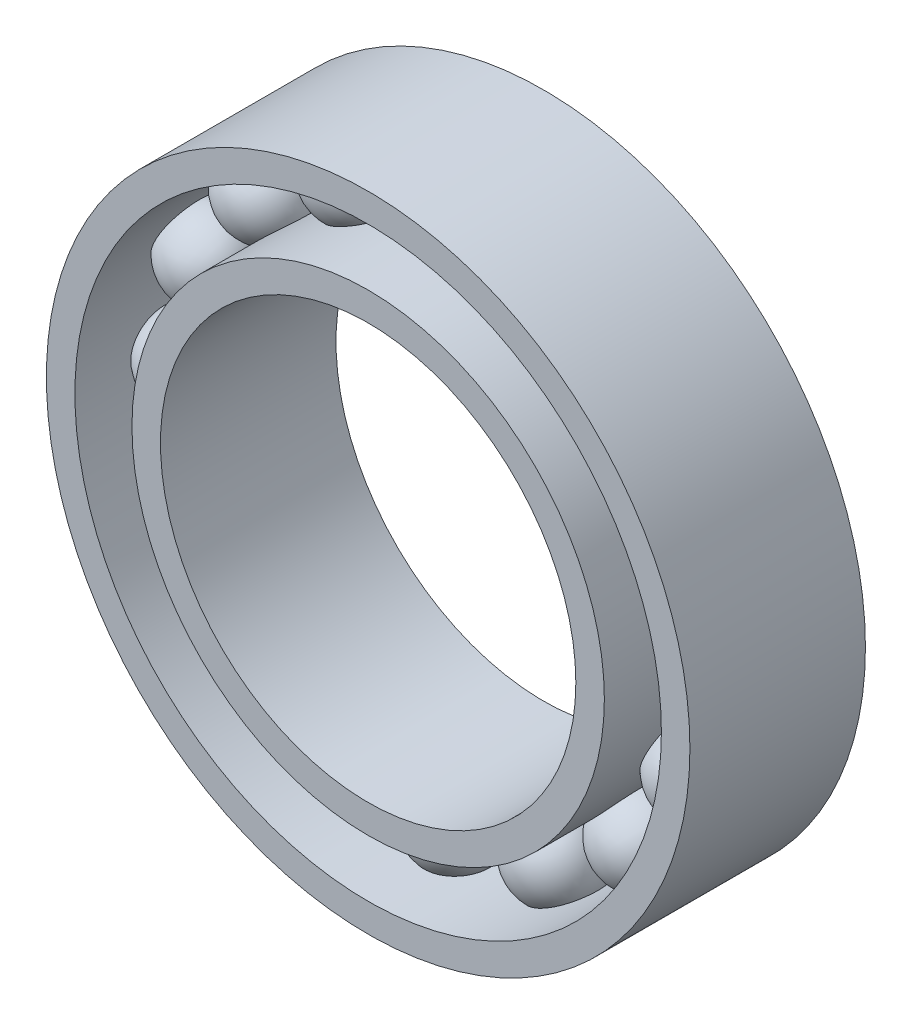
from build123d import *

# Parameters (mm, degrees)
SKETCH1_R           = 5.5
SKETCH1_R_2         = 3.55
BOSS_EXTRUDE1_DEPTH = 3
CUT_EXTRUDE1_REACH  = 10.337
SKETCH2_R           = 5.0125
SKETCH2_R_2         = 4.0375
CIRPATTERN1_COUNT   = 16


with BuildPart() as part:
    # Sketch1 → Boss-Extrude1 (new body)
    with BuildSketch(Plane.XY):
        Circle(SKETCH1_R)
        Circle(SKETCH1_R_2, mode=Mode.SUBTRACT)
    extrude(amount=BOSS_EXTRUDE1_DEPTH)

    # Sketch2 → Cut-Extrude1 (cut, up to next)
    with BuildSketch(Plane.XY, mode=Mode.PRIVATE) as cut_extrude1_sk1:
        Circle(SKETCH2_R)
        Circle(SKETCH2_R_2, mode=Mode.SUBTRACT)
    cut_extrude1_tool1 = extrude(cut_extrude1_sk1.sketch, amount=CUT_EXTRUDE1_REACH, mode=Mode.PRIVATE) & part.part
    add(cut_extrude1_tool1.solids().sort_by_distance((-4.870725, 0, 0))[0], mode=Mode.SUBTRACT)


with BuildPart() as cut_extrude1_piece_1:
    # of the separate pieces the step leaves, piece 1, a body of its own (cut_extrude1_pieces)
    add(part.part.solids().sort_by_distance((5.5, 0, 0))[0])



with BuildPart() as cut_extrude1_piece_2:
    # of the separate pieces the step leaves, piece 2, a body of its own (cut_extrude1_pieces)
    add(part.part.solids().sort_by_distance((4.0375, 0, 0))[0])


with BuildPart() as cut_extrude1_piece_1_1:
    add(cut_extrude1_piece_1.part)

    add(cut_extrude1_piece_2.part)  # Revolve1 merges Cut-Extrude1 piece 2
    # Sketch3 → Revolve1 (revolve)
    with BuildSketch(Plane(origin=(0, 0, 0), x_dir=(0, 0, -1), z_dir=(1, 0, 0))):
        with BuildLine():
            Line((-1.5, 5.25625), (-1.5, 3.79375))
            ThreePointArc((-1.5, 3.79375), (-0.76875, 4.525), (-1.5, 5.25625))
        make_face()
    revolve1 = revolve(axis=Axis((0, 5.25625, 1.5), (0, -1, 0)))

    # CirPattern1: Revolve1 ×16 about axis
    cirpattern1_axis = Axis((0, 0, -0.2), (0, 0, 1))
    for i in range(1, CIRPATTERN1_COUNT):
        add(revolve1.rotate(cirpattern1_axis, i * 360 / CIRPATTERN1_COUNT))


solid = cut_extrude1_piece_1_1.part
